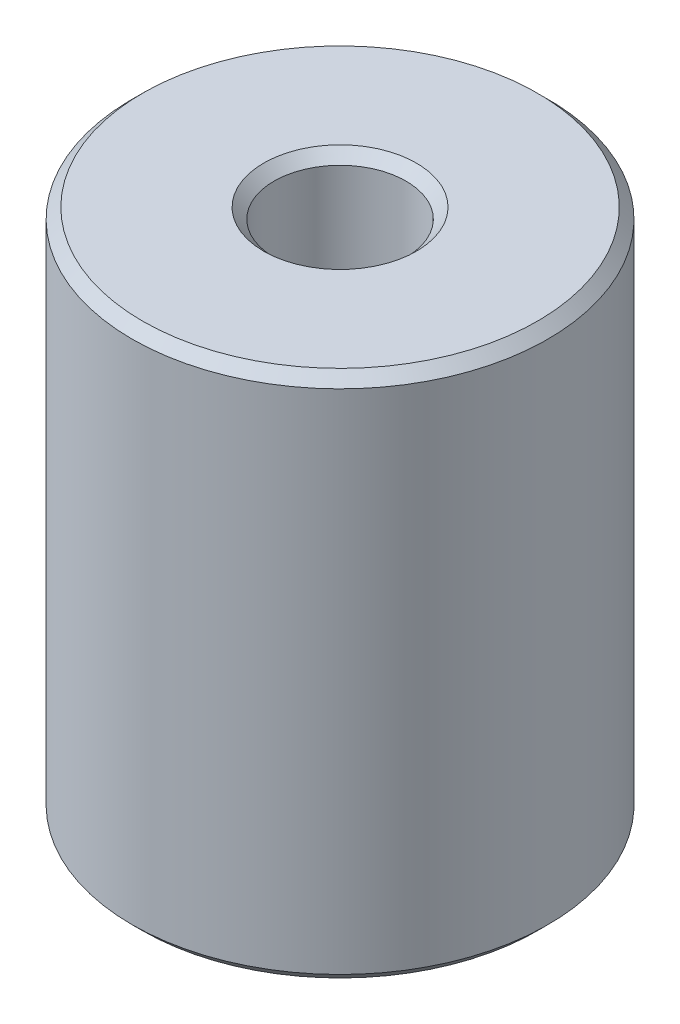
from build123d import *

# Parameters (mm, degrees)
SKETCH2_R           = 10
BOSS_EXTRUDE1_DEPTH = 25.4
SKETCH3_R           = 3.175
CUT_EXTRUDE1_DEPTH  = 12.7
CHAMFER1_SIZE       = 0.5
SKETCH4_R           = 4
CUT_EXTRUDE2_DEPTH  = 12.7


with BuildPart() as part:
    # Sketch2 → Boss-Extrude1 (new body)
    with BuildSketch(Plane(origin=(0, 0, 0), x_dir=(1, 0, 0), z_dir=(0, 1, 0))):
        with Locations(Location((0, 0, 0), (0, 0, 270))):
            Circle(SKETCH2_R)
    extrude(amount=BOSS_EXTRUDE1_DEPTH)

    # Sketch3 → Cut-Extrude1 (cut)
    with BuildSketch(Plane(origin=(0, 25.4, 0), x_dir=(1, 0, 0), z_dir=(0, 1, 0))):
        with Locations(Location((0, 0, 0), (0, 0, 270))):
            Circle(SKETCH3_R)
    extrude(amount=-CUT_EXTRUDE1_DEPTH, mode=Mode.SUBTRACT)

    # Chamfer1
    chamfer1_edges = [part.edges().sort_by_distance(p)[0] for p in [
        (0, 0, -10),
        (0, 25.4, -10),
        (0, 25.4, -3.175),
    ]]
    chamfer(chamfer1_edges, length=CHAMFER1_SIZE)

    # Sketch4 → Cut-Extrude2 (cut)
    with BuildSketch(Plane.XZ):
        with Locations(Location((0, 0, 0), (0, 0, 270))):
            Circle(SKETCH4_R)
    extrude(amount=-CUT_EXTRUDE2_DEPTH, mode=Mode.SUBTRACT)


solid = part.part
